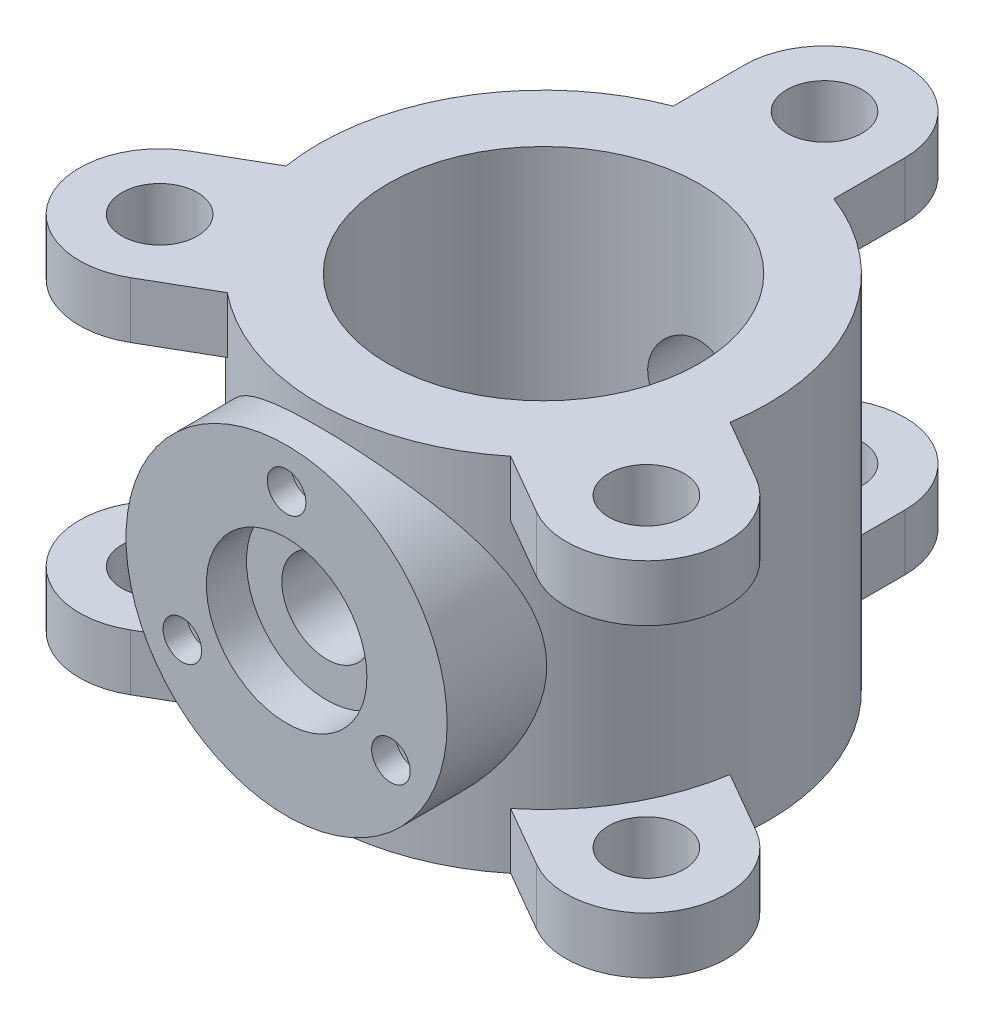
from build123d import *

# Parameters (mm, degrees)
SKETCH1_R                = 140
SKETCH1_R_2              = 97
BOSS_EXTRUDE7_DEPTH      = 225
SKETCH4_R                = 23.5
BOSS_EXTRUDE8_DEPTH      = 35
CIRPATTERN1_COUNT        = 3
MIRROR2_COPY_1_SKETCH_R  = 23.5
MIRROR2_COPY_1_DEPTH     = 35
MIRROR2_COPY_2_SKETCH_R  = 23.5
MIRROR2_COPY_2_DEPTH     = 35
BOSS_EXTRUDE9_REACH      = 491.361
BOSS_EXTRUDE9_END_RADIUS = 140
SKETCH6_R                = 100
SKETCH7_R                = 50
CUT_EXTRUDE1_DEPTH       = 25
SKETCH8_R                = 28
CUT_EXTRUDE2_DEPTH       = 470.945948606
SKETCH9_R                = 12
CUT_EXTRUDE3_DEPTH       = 15
CIRPATTERN4_COUNT        = 3


with BuildPart() as part:
    # Sketch1 → Boss-Extrude7 (new body)
    with BuildSketch(Plane(origin=(0, 0, 0), x_dir=(1, 0, 0), z_dir=(0, 1, 0))):
        with Locations(Location((0, 0, 0), (0, 0, 270))):
            Circle(SKETCH1_R)
        with Locations(Location((0, 0, 0), (0, 0, 270))):
            Circle(SKETCH1_R_2, mode=Mode.SUBTRACT)
    extrude(amount=BOSS_EXTRUDE7_DEPTH)

    # Sketch4 → Boss-Extrude8 (add)
    with BuildSketch(Plane(origin=(0, 225, 0), x_dir=(1, 0, 0), z_dir=(0, 1, 0))):
        with BuildLine():
            Line((50, 175), (50, 130.766968306))
            Line((50, 130.766968306), (-50, 130.766968306))
            Line((-50, 130.766968306), (-50, 175))
            ThreePointArc((-50, 175), (0, 225), (50, 175))
        make_face()
        with Locations(Location((0, 175, 0), (0, 0, 270))):
            Circle(SKETCH4_R, mode=Mode.SUBTRACT)
    boss_extrude8 = extrude(amount=-BOSS_EXTRUDE8_DEPTH)

    # CirPattern1: Boss-Extrude8 ×3 about axis
    cirpattern1_axis = Axis((0, 0, 0), (0, 1, 0))
    for i in range(1, CIRPATTERN1_COUNT):
        add(boss_extrude8.rotate(cirpattern1_axis, i * 360 / CIRPATTERN1_COUNT))

    # Mirror2: Boss-Extrude8 across plane
    add(boss_extrude8.mirror(Plane.ZX.offset(112.5)))

    # Mirror2 copy 1 sketch → Mirror2 copy 1 (add)
    with BuildSketch(Plane(origin=(0, 0, 0), x_dir=(-0.4999999999999998, 0, -0.8660254037844387), z_dir=(0, -1, 0))):
        with BuildLine():
            Line((50, -175), (50, -130.766968306))
            Line((50, -130.766968306), (-50, -130.766968306))
            Line((-50, -130.766968306), (-50, -175))
            ThreePointArc((-50, -175), (0, -225), (50, -175))
        make_face()
        with Locations((0, -175)):
            Circle(MIRROR2_COPY_1_SKETCH_R, mode=Mode.SUBTRACT)
    extrude(amount=-MIRROR2_COPY_1_DEPTH)

    # Mirror2 copy 2 sketch → Mirror2 copy 2 (add)
    with BuildSketch(Plane(origin=(0, 0, 0), x_dir=(-0.5000000000000004, 0, 0.8660254037844384), z_dir=(0, -1, 0))):
        with BuildLine():
            Line((50, -175), (50, -130.766968306))
            Line((50, -130.766968306), (-50, -130.766968306))
            Line((-50, -130.766968306), (-50, -175))
            ThreePointArc((-50, -175), (0, -225), (50, -175))
        make_face()
        with Locations((0, -175)):
            Circle(MIRROR2_COPY_2_SKETCH_R, mode=Mode.SUBTRACT)
    extrude(amount=-MIRROR2_COPY_2_DEPTH)

    # Boss-Extrude9: up to this cylinder (the profile starts outside it)
    boss_extrude9_end = Plane(origin=(0, 112.5, 0), z_dir=(0, -1, 0)) * Cylinder(BOSS_EXTRUDE9_END_RADIUS, 1263.722, mode=Mode.PRIVATE)
    # Sketch6 → Boss-Extrude9 (add, up to the surface)
    with BuildSketch(Plane.XY.offset(160), mode=Mode.PRIVATE) as boss_extrude9_sk1:
        with Locations((0, 112.5)):
            Circle(SKETCH6_R)
    boss_extrude9_tool1 = extrude(boss_extrude9_sk1.sketch, amount=-BOSS_EXTRUDE9_REACH, mode=Mode.PRIVATE) - boss_extrude9_end
    add(boss_extrude9_tool1.solids().sort_by_distance((0, 112.5, 160))[0])

    # Sketch7 → Cut-Extrude1 (cut)
    with BuildSketch(Plane.XY.offset(160)):
        with Locations((0, 112.5)):
            Circle(SKETCH7_R)
    extrude(amount=-CUT_EXTRUDE1_DEPTH, mode=Mode.SUBTRACT)

    # Sketch8 → Cut-Extrude2 (cut, through all)
    with BuildSketch(Plane.XY.offset(135)):
        with Locations((0, 112.5)):
            Circle(SKETCH8_R)
    extrude(amount=-CUT_EXTRUDE2_DEPTH, mode=Mode.SUBTRACT)

    # Sketch9 → Cut-Extrude3 (cut)
    with BuildSketch(Plane.XY.offset(160)):
        with Locations((0, 187.5)):
            Circle(SKETCH9_R)
    cut_extrude3 = extrude(amount=-CUT_EXTRUDE3_DEPTH, mode=Mode.SUBTRACT)

    # CirPattern4: Cut-Extrude3 ×3 about axis
    cirpattern4_axis = Axis((0, 112.5, 0), (0, 0, 1))
    for i in range(1, CIRPATTERN4_COUNT):
        add(cut_extrude3.rotate(cirpattern4_axis, i * 360 / CIRPATTERN4_COUNT), mode=Mode.SUBTRACT)


solid = part.part
